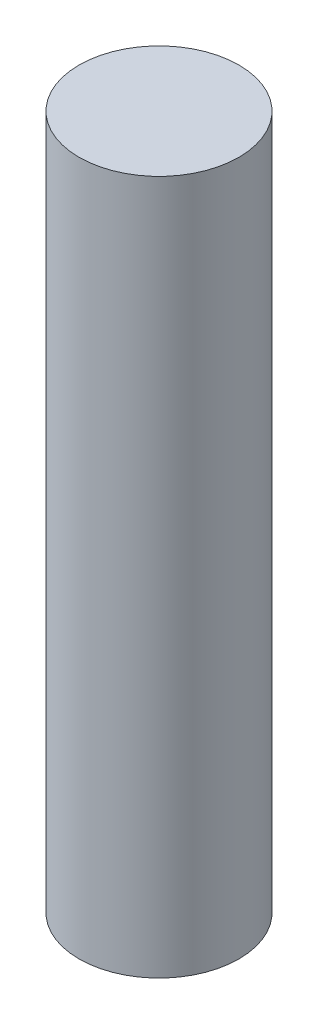
from build123d import *

# Parameters (mm, degrees)
SKETCH_1_R      = 4.49
EXTRUDE_1_DEPTH = 39


with BuildPart() as part:
    # 草图1 → 凸台-拉伸1 (new body)
    with BuildSketch(Plane(origin=(0, 0, 0), x_dir=(1, 0, 0), z_dir=(0, 1, 0))):
        with Locations(Location((0, 0, 0), (0, 0, 270))):
            Circle(SKETCH_1_R)
    extrude(amount=EXTRUDE_1_DEPTH)


solid = part.part
